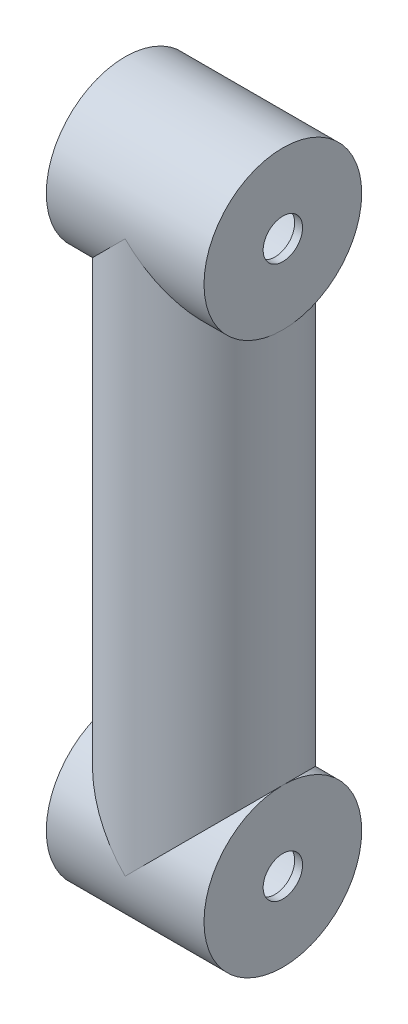
from build123d import *
from build123d.topology import SkipClean

# Parameters (mm, degrees)
SKETCH1_R           = 20
SKETCH1_R_2         = 18
BOSS_EXTRUDE1_DEPTH = 70
SKETCH2_R           = 20
CUT_EXTRUDE1_DEPTH  = 20
SKETCH3_R           = 20
SKETCH3_R_2         = 18
BOSS_EXTRUDE2_DEPTH = 20
BOSS_EXTRUDE3_START = -2
SKETCH4_R           = 18
SKETCH4_R_2         = 5
BOSS_EXTRUDE3_DEPTH = 2
SKETCH5_R           = 5
CUT_EXTRUDE2_DEPTH  = 70


with BuildPart() as part:
    # Sketch1 → Boss-Extrude1 (new body)
    with BuildSketch(Plane(origin=(0, 0, 0), x_dir=(1, 0, 0), z_dir=(0, 1, 0))):
        with Locations(Location((0, 0, 0), (0, 0, 270))):
            Circle(SKETCH1_R)
        with Locations(Location((0, 0, 0), (0, 0, 270))):
            Circle(SKETCH1_R_2, mode=Mode.SUBTRACT)
    boss_extrude1 = extrude(amount=BOSS_EXTRUDE1_DEPTH)

    # Sketch2 → Cut-Extrude1 (cut, symmetric)
    with BuildSketch(Plane(origin=(0, 0, 0), x_dir=(0, 0, -1), z_dir=(1, 0, 0))):
        with Locations((0, 70)):
            Circle(SKETCH2_R)
    cut_extrude1 = extrude(amount=CUT_EXTRUDE1_DEPTH, both=True, mode=Mode.SUBTRACT)

    # Sketch3 → Boss-Extrude2 (add, symmetric)
    with SkipClean():  # the faces are left unmerged after this step: merging them gives an invalid solid
        with BuildSketch(Plane(origin=(0, 0, 0), x_dir=(0, 0, -1), z_dir=(1, 0, 0))):
            with Locations((0, 70)):
                Circle(SKETCH3_R)
            with Locations((0, 70)):
                Circle(SKETCH3_R_2, mode=Mode.SUBTRACT)
        boss_extrude2 = extrude(amount=BOSS_EXTRUDE2_DEPTH, both=True)

    # Sketch4 → Boss-Extrude3 (add)
    with SkipClean():  # the faces are left unmerged after this step: merging them gives an invalid solid
        with BuildSketch(Plane(origin=(20, 0, 0), x_dir=(0, 0, -1), z_dir=(1, 0, 0)).offset(BOSS_EXTRUDE3_START)):
            with Locations((0, 70)):
                Circle(SKETCH4_R)
            with Locations((0, 70)):
                Circle(SKETCH4_R_2, mode=Mode.SUBTRACT)
        boss_extrude3 = extrude(amount=BOSS_EXTRUDE3_DEPTH)

    # Sketch5 → Cut-Extrude2 (cut)
    with SkipClean():  # the faces are left unmerged after this step: merging them gives an invalid solid
        with BuildSketch(Plane.XZ):
            with Locations(Location((0, 0, 0), (0, 0, 270))):
                Circle(SKETCH5_R)
        cut_extrude2 = extrude(amount=-CUT_EXTRUDE2_DEPTH, mode=Mode.SUBTRACT)

    # Mirror1: Boss-Extrude1, Cut-Extrude1, Boss-Extrude2, Boss-Extrude3, Cut-Extrude2 across plane
    with SkipClean():  # the faces are left unmerged after this step: merging them gives an invalid solid
        add(boss_extrude1.mirror(Plane.ZX))
        add(cut_extrude1.mirror(Plane.ZX), mode=Mode.SUBTRACT)
        add(boss_extrude2.mirror(Plane.ZX))
        add(boss_extrude3.mirror(Plane.ZX))
        add(cut_extrude2.mirror(Plane.ZX), mode=Mode.SUBTRACT)


solid = part.part
